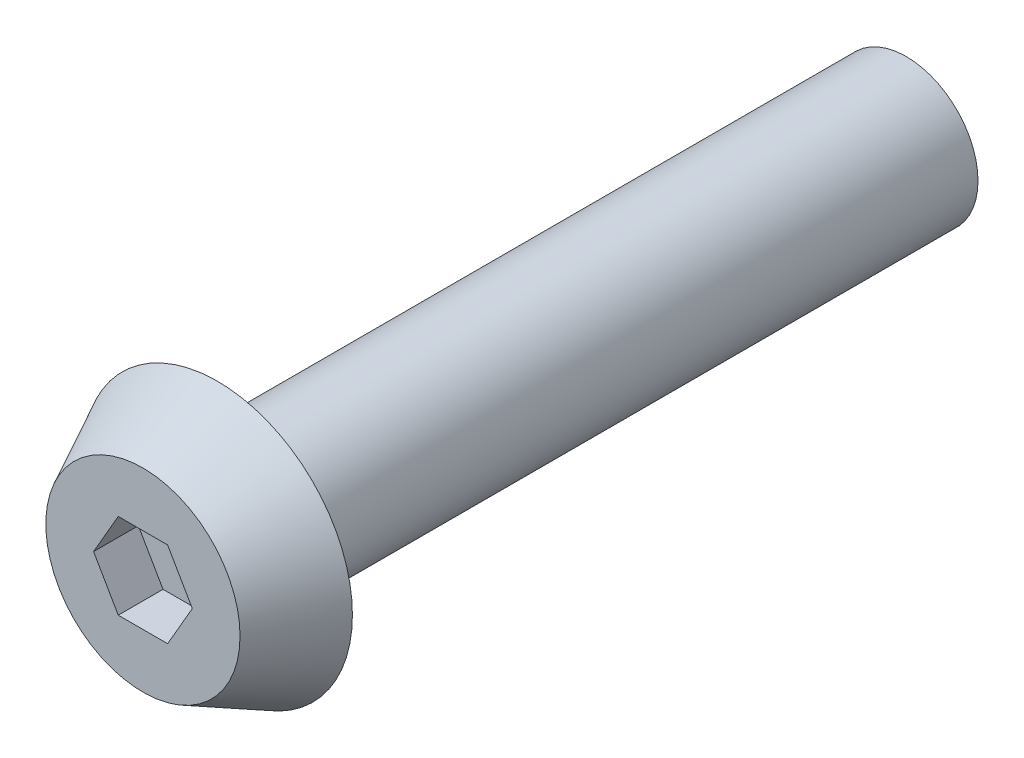
from build123d import *

# Parameters (mm, degrees)
SK_SHANK_R   = 1.25
SHANK_DEPTH  = 12
SK_HEAD_R    = 2.35
HEAD_DEPTH   = 1.3
HEAD_TAPER   = 26.84642782
SOCKET_START = 0.52
SOCKET_DEPTH = 1.28


with BuildPart() as part:
    # SK_shank → Shank (new body)
    with BuildSketch(Plane.XY):
        Circle(SK_SHANK_R)
    extrude(amount=-SHANK_DEPTH)

    # SK_head → Head (add)
    with BuildSketch(Plane.XY):
        Circle(SK_HEAD_R)
    extrude(amount=HEAD_DEPTH, taper=HEAD_TAPER)

    # SK_socket → Socket (cut)
    with BuildSketch(Plane.XY.offset(SOCKET_START)):
        Polygon((0.860251901, 0), (0.430125951, -0.745), (-0.430125951, -0.745), (-0.860251901, 0), (-0.430125951, 0.745), (0.430125951, 0.745), align=None)
    extrude(amount=SOCKET_DEPTH, mode=Mode.SUBTRACT)


solid = part.part
